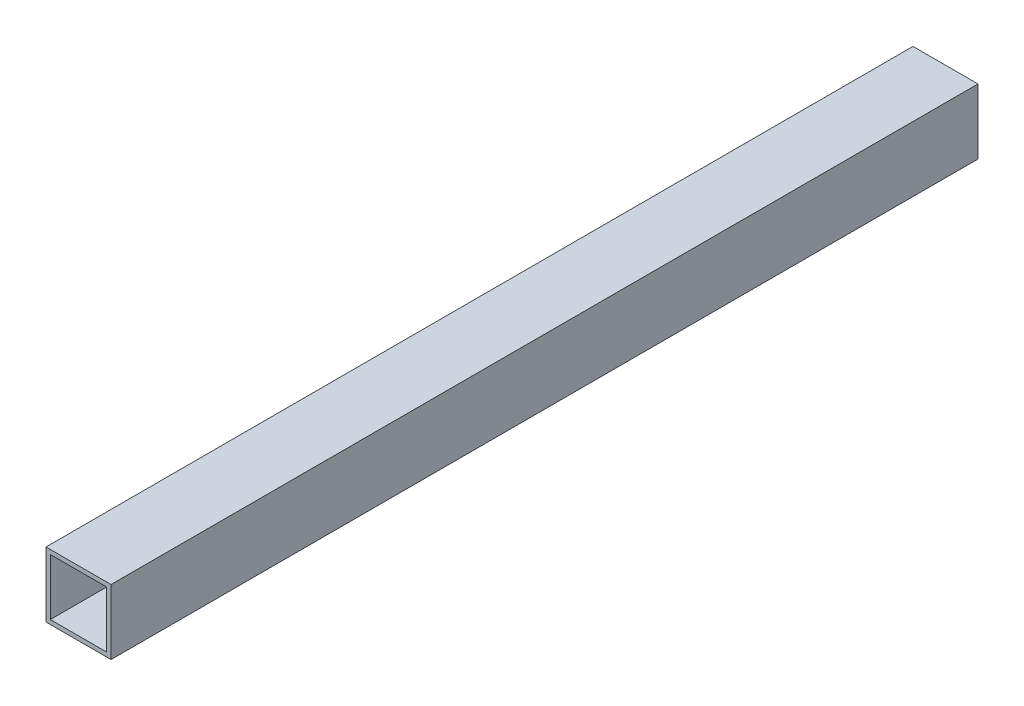
from build123d import *

# Parameters (mm, degrees)
SKETCH_1_W      = 15
SKETCH_1_H      = 15
SKETCH_1_W_2    = 13
SKETCH_1_H_2    = 13
EXTRUDE_1_DEPTH = 200


with BuildPart() as part:
    # 草图1 → 拉伸-薄壁1 (new body)
    with BuildSketch(Plane.XY):
        with Locations((7.5, -7.5)):
            Rectangle(SKETCH_1_W, SKETCH_1_H)
        with Locations((7.5, -7.5)):
            Rectangle(SKETCH_1_W_2, SKETCH_1_H_2, mode=Mode.SUBTRACT)
    extrude(amount=EXTRUDE_1_DEPTH)


solid = part.part
